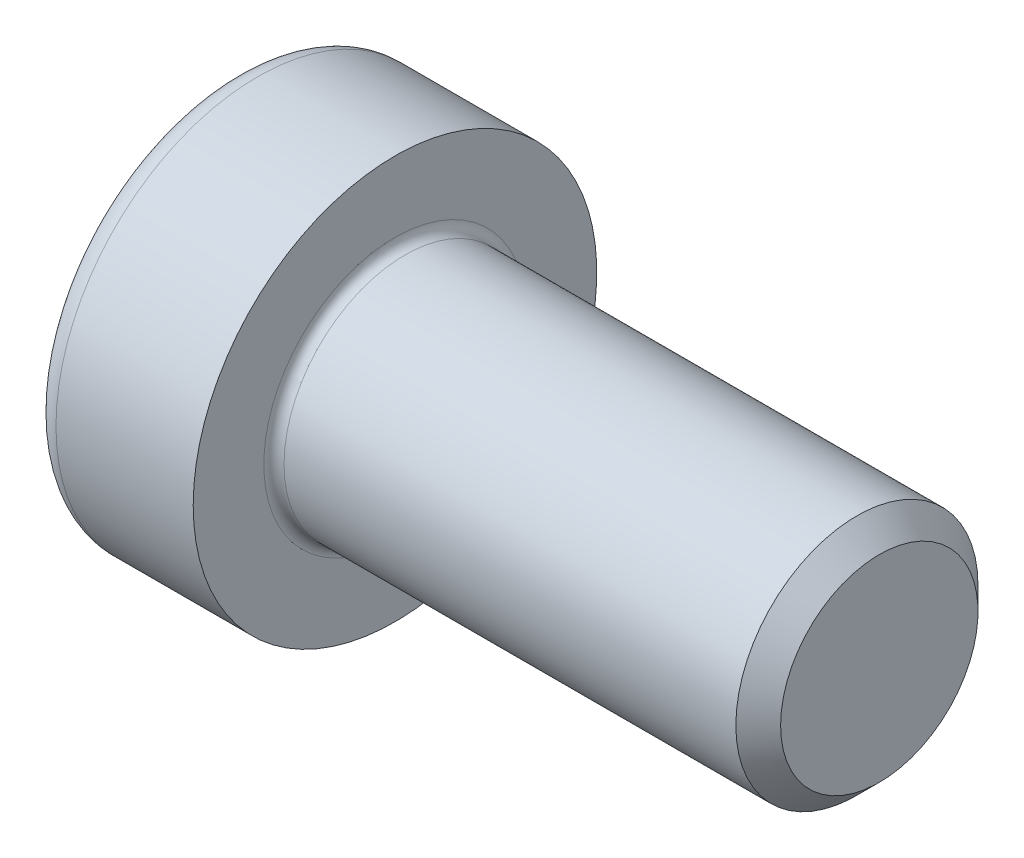
from build123d import *

# Parameters (mm, degrees)
FILLET1_R   = 0.25
FILLET2_R   = 0.6
HEX_2_DEPTH = 2.5


with BuildPart() as part:
    # BodySke → Base-Revolve (revolve)
    with BuildSketch(Plane.XY, mode=Mode.PRIVATE) as base_revolve_sk:
        Polygon((0, 0), (0, 5), (4, 5), (4, 3), (15.4455, 3), (16, 2.4455), (16, 0), align=None)
    revolve(base_revolve_sk.sketch.rotate(Axis((-31.75, 0, 0), (1, 0, 0)), 90), axis=Axis((-31.75, 0, 0), (1, 0, 0)))

    # Fillet1
    fillet1_edges = [part.edges().sort_by_distance(p)[0] for p in [
        (4, 0, -3),
    ]]
    fillet(fillet1_edges, radius=FILLET1_R)

    # Fillet2
    fillet2_edges = [part.edges().sort_by_distance(p)[0] for p in [
        (0, 0, -5),
    ]]
    fillet(fillet2_edges, radius=FILLET2_R)

    # HexSke → Hex 2 (cut)
    with BuildSketch(Plane(origin=(0, 0, 0), x_dir=(0, 0.500000000000001, 0.866025403784438), z_dir=(-1, 0, 0))):
        Polygon((1.443375673, 2.5), (-1.443375673, 2.5), (-2.886751346, 0), (-1.443375673, -2.5), (1.443375673, -2.5), (2.886751346, 0), align=None)
    extrude(amount=-HEX_2_DEPTH, mode=Mode.SUBTRACT)

    # PilotSke → Hex-PreBroach (revolve, cut)
    with BuildSketch(Plane.XY, mode=Mode.PRIVATE) as hex_prebroach_sk:
        Polygon((0, 2.5), (2.5, 2.5), (3.077350269, 1.5), (5, 1.5), (5.866025404, 0), (0, 0), align=None)
    revolve(hex_prebroach_sk.sketch.rotate(Axis((0, 0, 0), (1, 0, 0)), 90), axis=Axis((0, 0, 0), (1, 0, 0)), mode=Mode.SUBTRACT)


solid = part.part
